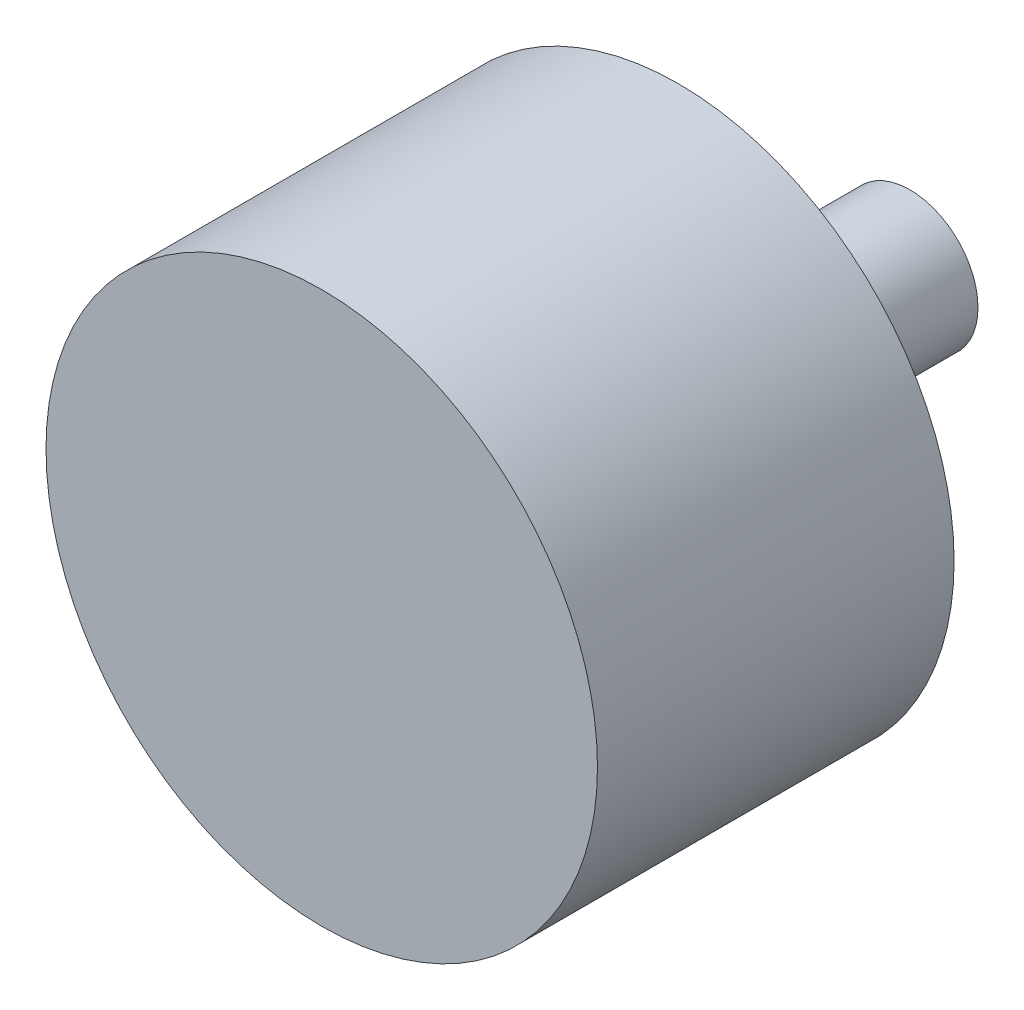
from build123d import *


with BuildPart() as part:
    # Sketch1 → Revolve1 (revolve)
    with BuildSketch(Plane(origin=(0, 0, 0), x_dir=(0, 0, -1), z_dir=(1, 0, 0)), mode=Mode.PRIVATE) as revolve1_sk:
        Polygon((0, 0), (0, 19.05), (24.638, 19.05), (24.638, 5.461), (30.48, 5.461), (30.48, 4.699), (40.64, 4.699), (40.64, 0), align=None)
    revolve(revolve1_sk.sketch.rotate(Axis((0, 0, 0), (0, 0, -1)), 90), axis=Axis((0, 0, 0), (0, 0, -1)))


solid = part.part
